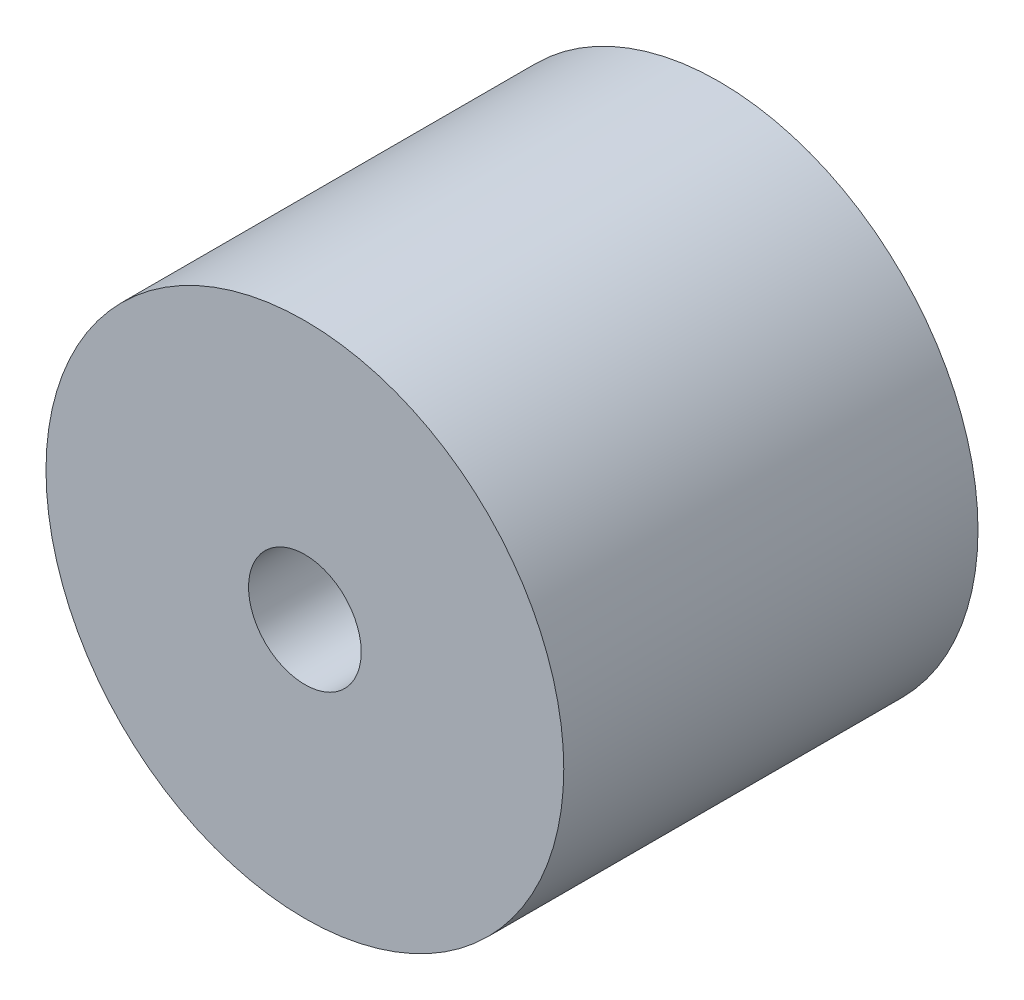
from build123d import *

# Parameters (mm, degrees)
SKETCH1_R             = 7.9375
BOSS_EXTRUDE1_DEPTH   = 12.7
F_8_32_TAPPED_HOLE1_D = 3.4544


with BuildPart() as part:
    # Sketch1 → Boss-Extrude1 (new body)
    with BuildSketch(Plane.XY):
        Circle(SKETCH1_R)
    extrude(amount=BOSS_EXTRUDE1_DEPTH)

    # #8-32 Tapped Hole1 (through all)
    with Locations(Plane.XY.offset(12.7)):
        with Locations((0, 0)):
            Hole(F_8_32_TAPPED_HOLE1_D / 2)


solid = part.part
